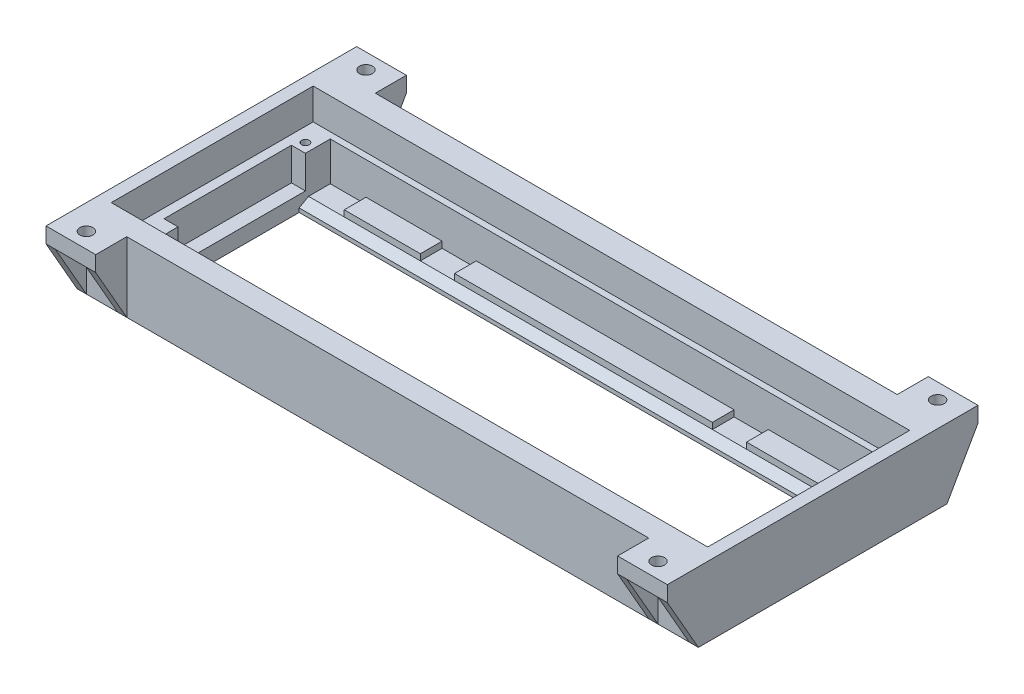
from build123d import *
from OCP.BRepFilletAPI import BRepFilletAPI_MakeChamfer

# Parameters (mm, degrees)
SKETCH_1_W          = 200
SKETCH_1_H          = 80
SKETCH_1_W_2        = 177
SKETCH_1_H_2        = 40
EXTRUDE_1_DEPTH     = 5
CHAMFER_1_SIZE      = 3
CHAMFER_1_SIZE2     = 1.732050808
SKETCH_2_W          = 200
SKETCH_2_H          = 80
EXTRUDE_2_DEPTH     = 2
SKETCH_3_W          = 200
SKETCH_3_H          = 80
SKETCH_3_R          = 1.25
EXTRUDE_3_DEPTH     = 10.5
SKETCH_4_W          = 200
SKETCH_4_H          = 80
SKETCH_4_W_2        = 192
SKETCH_4_H_2        = 65
EXTRUDE_4_DEPTH     = 10
CHAMFER_2_SIZE      = 5
SKETCH_6_W          = 16
SKETCH_6_H          = 10
SKETCH_6_R          = 2.1
EXTRUDE_6_DEPTH     = 5
EXTRUDE_9_DEPTH     = 16
EXTRUDE_10_DEPTH    = 16
SKETCH_12_W         = 10
SKETCH_12_H         = 10
CUT_EXTRUDE_2_DEPTH = 22
CHAMFER_3_SIZE      = 2
CHAMFER_3_SIZE2     = 3.464101615


with BuildPart() as part:
    # Эскиз1 → Бобышка-Вытянуть1 (new body)
    with BuildSketch(Plane(origin=(0, 0, 0), x_dir=(1, 0, 0), z_dir=(0, 1, 0))):
        Rectangle(SKETCH_1_W, SKETCH_1_H)
        Rectangle(SKETCH_1_W_2, SKETCH_1_H_2, mode=Mode.SUBTRACT)
    extrude(amount=EXTRUDE_1_DEPTH)

    # Фаска1
    chamfer_1_edges = [part.edges().sort_by_distance(p)[0] for p in [
        (0, 5, -20),
        (0, 5, 20),
    ]]
    chamfer_1_side = [part.faces().sort_by_distance(p)[0] for p in [
        (0, 5, -37.845934077),
    ]]
    chamfer(chamfer_1_edges, length=CHAMFER_1_SIZE, length2=CHAMFER_1_SIZE2, reference=chamfer_1_side[0])

    # Эскиз2 → Бобышка-Вытянуть2 (add)
    with BuildSketch(Plane(origin=(0, 5, 0), x_dir=(1, 0, 0), z_dir=(0, 1, 0))):
        Rectangle(SKETCH_2_W, SKETCH_2_H)
        Polygon((-88.5, 30), (-88.5, -28), (-48.5, -28), (-48.5, -32), (-32.5, -32), (-32.5, -28), (32.5, -28), (32.5, -32), (48.5, -32), (48.5, -28), (88.5, -28), (88.5, 30), (77, 30), (77, 23), (52.5, 23), (52.5, 30), (41.5, 30), (41.5, 23), (-41.5, 23), (-41.5, 30), (-52.5, 30), (-52.5, 23), (-77, 23), (-77, 30), align=None, mode=Mode.SUBTRACT)
    extrude(amount=EXTRUDE_2_DEPTH)

    # Эскиз3 → Бобышка-Вытянуть3 (add)
    with BuildSketch(Plane(origin=(0, 7, 0), x_dir=(1, 0, 0), z_dir=(0, 1, 0))):
        Rectangle(SKETCH_3_W, SKETCH_3_H)
        with Locations(Location((-91.5, 25, 0), (0, 0, 90))):
            Circle(SKETCH_3_R, mode=Mode.SUBTRACT)
        with Locations(Location((91.5, 25, 0), (0, 0, 90))):
            Circle(SKETCH_3_R, mode=Mode.SUBTRACT)
        with Locations(Location((-91.5, -27, 0), (0, 0, 90))):
            Circle(SKETCH_3_R, mode=Mode.SUBTRACT)
        with Locations(Location((91.5, -27, 0), (0, 0, 90))):
            Circle(SKETCH_3_R, mode=Mode.SUBTRACT)
        Polygon((-93, 22), (-88.5, 22), (-88.5, 30), (88.5, 30), (88.5, 22), (93, 22), (93, -19), (88.5, -19), (88.5, -33), (-88.5, -33), (-88.5, -19), (-93, -19), align=None, mode=Mode.SUBTRACT)
    extrude(amount=EXTRUDE_3_DEPTH)

    # Эскиз4 → Бобышка-Вытянуть4 (add)
    with BuildSketch(Plane(origin=(0, 17.5, 0), x_dir=(1, 0, 0), z_dir=(0, 1, 0))):
        Rectangle(SKETCH_4_W, SKETCH_4_H)
        with Locations((0, -0.5)):
            Rectangle(SKETCH_4_W_2, SKETCH_4_H_2, mode=Mode.SUBTRACT)
    extrude(amount=EXTRUDE_4_DEPTH)

    # Фаска2
    chamfer_2_edges = [part.edges().sort_by_distance(p)[0] for p in [
        (0, 0, -40),
        (100, 0, 0),
        (0, 0, 40),
        (-100, 0, 0),
    ]]
    chamfer(chamfer_2_edges, length=CHAMFER_2_SIZE)

    # Эскиз6 → Бобышка-Вытянуть6 (add)
    # profile 1 of 4: a face of its own
    with BuildSketch(Plane(origin=(0, 27.5, 0), x_dir=(1, 0, 0), z_dir=(0, 1, 0))):
        with Locations((-92, 45)):
            Rectangle(SKETCH_6_W, SKETCH_6_H)
        with Locations(Location((-92, 45, 0), (0, 0, 270))):
            Circle(SKETCH_6_R, mode=Mode.SUBTRACT)
    # profile 2 of 4: a face of its own
    with BuildSketch(Plane(origin=(0, 27.5, 0), x_dir=(1, 0, 0), z_dir=(0, 1, 0))):
        with Locations((92, 45)):
            Rectangle(SKETCH_6_W, SKETCH_6_H)
        with Locations(Location((92, 45, 0), (0, 0, 270))):
            Circle(SKETCH_6_R, mode=Mode.SUBTRACT)
    # profile 3 of 4: a face of its own
    with BuildSketch(Plane(origin=(0, 27.5, 0), x_dir=(1, 0, 0), z_dir=(0, 1, 0))):
        with Locations((92, -45)):
            Rectangle(SKETCH_6_W, SKETCH_6_H)
        with Locations(Location((92, -45, 0), (0, 0, 270))):
            Circle(SKETCH_6_R, mode=Mode.SUBTRACT)
    # profile 4 of 4: a face of its own
    with BuildSketch(Plane(origin=(0, 27.5, 0), x_dir=(1, 0, 0), z_dir=(0, 1, 0))):
        with Locations((-92, -45)):
            Rectangle(SKETCH_6_W, SKETCH_6_H)
        with Locations(Location((-92, -45, 0), (0, 0, 270))):
            Circle(SKETCH_6_R, mode=Mode.SUBTRACT)
    extrude(amount=-EXTRUDE_6_DEPTH)

    # Эскиз10 → Бобышка-Вытянуть9 (add)
    with BuildSketch(Plane(origin=(100, 0, 0), x_dir=(0, 0, -1), z_dir=(1, 0, 0))):
        Polygon((-50, 22.5), (-40, 5), (-40, 22.5), align=None)
        Polygon((40, 5), (50, 22.5), (40, 22.5), align=None)
    extrude(amount=-EXTRUDE_9_DEPTH)

    # Эскиз11 → Бобышка-Вытянуть10 (add)
    with BuildSketch(Plane.ZY.offset(100)):
        Polygon((-50, 22.5), (-40, 22.5), (-40, 5), align=None)
        Polygon((40, 5), (50, 22.5), (40, 22.5), align=None)
    extrude(amount=-EXTRUDE_10_DEPTH)

    # Эскиз12 → Вырез-Вытянуть2 (cut)
    with BuildSketch(Plane(origin=(0, 22.5, 0), x_dir=(1, 0, 0), z_dir=(0, 1, 0))):
        with Locations((-92, -45)):
            Rectangle(SKETCH_12_W, SKETCH_12_H)
        with Locations((-92, 45)):
            Rectangle(SKETCH_12_W, SKETCH_12_H)
        with Locations((92, 45)):
            Rectangle(SKETCH_12_W, SKETCH_12_H)
        with Locations((92, -45)):
            Rectangle(SKETCH_12_W, SKETCH_12_H)
    extrude(amount=-CUT_EXTRUDE_2_DEPTH, mode=Mode.SUBTRACT)

    # Фаска3: one chamfer whose edges measure the first distance from different faces: ONE call of the kernel's chamfer builder (chamfer() names one face for all edges)
    chamfer_3_edges_1 = [part.edges().sort_by_distance(p)[0] for p in [
        (88.5, 0, 0),
    ]]
    chamfer_3_side_1 = [part.faces().sort_by_distance(p)[0] for p in [
        (88.5, 1.633974596, -19.346146041),
    ]]
    chamfer_3_edges_2 = [part.edges().sort_by_distance(p)[0] for p in [
        (0, 0, -20),
    ]]
    chamfer_3_side_2 = [part.faces().sort_by_distance(p)[0] for p in [
        (0, 1.633974596, -20),
    ]]
    chamfer_3_edges_3 = [part.edges().sort_by_distance(p)[0] for p in [
        (-88.5, 0, 0),
    ]]
    chamfer_3_side_3 = [part.faces().sort_by_distance(p)[0] for p in [
        (-88.5, 1.633974596, 19.346146041),
    ]]
    chamfer_3_edges_4 = [part.edges().sort_by_distance(p)[0] for p in [
        (0, 0, 20),
    ]]
    chamfer_3_side_4 = [part.faces().sort_by_distance(p)[0] for p in [
        (0, 1.633974596, 20),
    ]]
    chamfer_3 = BRepFilletAPI_MakeChamfer(part.part.solid().wrapped)
    for e in chamfer_3_edges_1:
        chamfer_3.Add(CHAMFER_3_SIZE, CHAMFER_3_SIZE2, e.wrapped, chamfer_3_side_1[0].wrapped)  # the first distance lies on this face
    for e in chamfer_3_edges_2:
        chamfer_3.Add(CHAMFER_3_SIZE, CHAMFER_3_SIZE2, e.wrapped, chamfer_3_side_2[0].wrapped)  # the first distance lies on this face
    for e in chamfer_3_edges_3:
        chamfer_3.Add(CHAMFER_3_SIZE, CHAMFER_3_SIZE2, e.wrapped, chamfer_3_side_3[0].wrapped)  # the first distance lies on this face
    for e in chamfer_3_edges_4:
        chamfer_3.Add(CHAMFER_3_SIZE, CHAMFER_3_SIZE2, e.wrapped, chamfer_3_side_4[0].wrapped)  # the first distance lies on this face
    add(Compound.cast(chamfer_3.Shape()), mode=Mode.REPLACE)


solid = part.part
